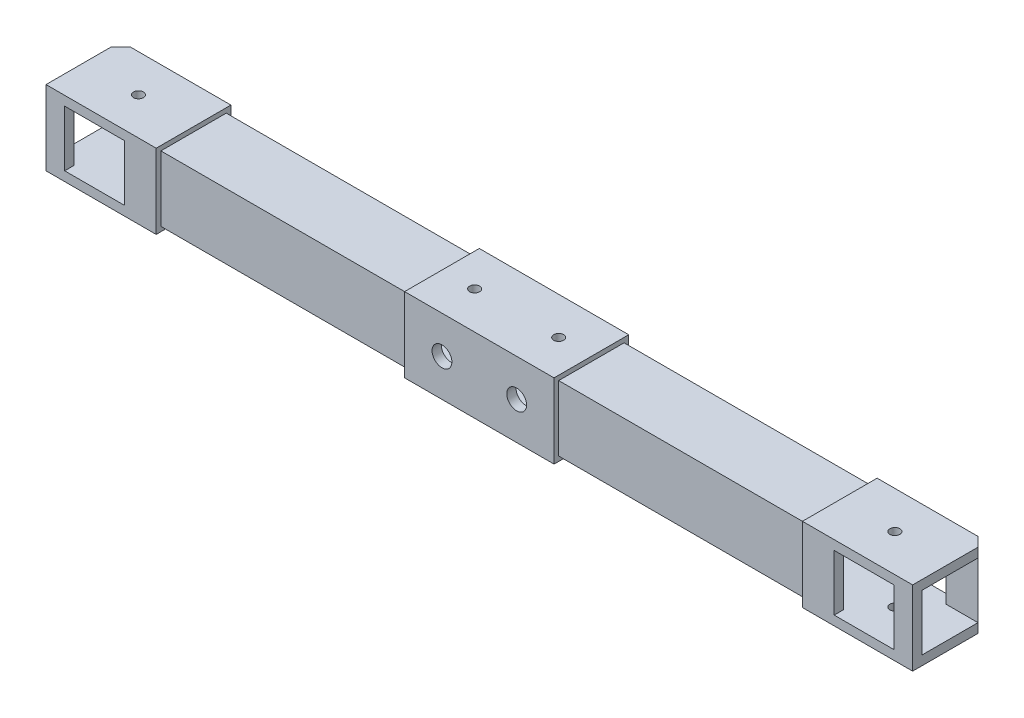
from build123d import *

# Parameters (mm, degrees)
SKETCH1_W               = 50.8
SKETCH1_H               = 50.8
SKETCH1_W_2             = 38.1
SKETCH1_H_2             = 38.1
EXTRUDE1_DEPTH          = 355.6
F_1_2_CLEARANCE_HOLE1_D = 13.49248
EXTRUDE3_REACH          = 362.107
SKETCH6_W               = 40.64
SKETCH6_H               = 38.1
EXTRUDE4_REACH          = 362.107
SKETCH7_W               = 40.64
SKETCH7_H               = 38.1
SKETCH8_W               = 48.26
SKETCH8_H               = 50.8
EXTRUDE5_DEPTH          = 361.10715072
F_1_4_CLEARANCE_HOLE1_D = 6.7564
F_1_4_CLEARANCE_HOLE2_D = 6.7564
EXTRUDE6_DEPTH          = 361.10715072
EXTRUDE8_REACH          = 314.544
SKETCH17_R              = 9.525
SKETCH18_W              = 12.7
SKETCH18_H              = 50.8
EXTRUDE9_DEPTH          = 313.54387788
SKETCH19_W              = 168.91
SKETCH19_H              = 50.8
EXTRUDE10_DEPTH         = 3.175
SKETCH20_W              = 168.91
SKETCH20_H              = 44.45
EXTRUDE11_DEPTH         = 3.175
MIRROR5_COPY_1_SKETCH_W = 168.91
MIRROR5_COPY_1_SKETCH_H = 50.8
MIRROR5_COPY_1_DEPTH    = 3.175
MIRROR5_COPY_2_SKETCH_W = 168.91
MIRROR5_COPY_2_SKETCH_H = 44.45
MIRROR5_COPY_2_DEPTH    = 3.175


with BuildPart() as part:
    # Sketch1 → Extrude1 (new, symmetric)
    with BuildSketch(Plane(origin=(0, 0, 0), x_dir=(0, 0, -1), z_dir=(1, 0, 0))):
        Rectangle(SKETCH1_W, SKETCH1_H)
        Rectangle(SKETCH1_W_2, SKETCH1_H_2, mode=Mode.SUBTRACT)
    extrude(amount=EXTRUDE1_DEPTH, both=True)

    # 1/2 Clearance Hole1 (through all)
    with Locations(Plane.XY.offset(25.4)):
        with Locations((25.4, 0), (-25.4, 0)):
            Hole(F_1_2_CLEARANCE_HOLE1_D / 2)

    # Sketch6 → Extrude3 (cut, up to next)
    with BuildSketch(Plane.XY.offset(25.4), mode=Mode.PRIVATE) as extrude3_sk1:
        with Locations((-261.62, 0)):
            Rectangle(SKETCH6_W, SKETCH6_H)
    extrude3_tool1 = extrude(extrude3_sk1.sketch, amount=-EXTRUDE3_REACH, mode=Mode.PRIVATE) & part.part
    extrude3 = extrude3_tool1.solids().sort_by_distance((-261.62, 0, 25.4))[0]
    add(extrude3, mode=Mode.SUBTRACT)

    # Sketch7 → Extrude4 (cut, up to next)
    with BuildSketch(Plane(origin=(0, 0, -25.4), x_dir=(-1, 0, 0), z_dir=(0, 0, -1)), mode=Mode.PRIVATE) as extrude4_sk1:
        with Locations((252.73, 0)):
            Rectangle(SKETCH7_W, SKETCH7_H)
    extrude4_tool1 = extrude(extrude4_sk1.sketch, amount=-EXTRUDE4_REACH, mode=Mode.PRIVATE) & part.part
    extrude4 = extrude4_tool1.solids().sort_by_distance((-252.73, 0, -25.4))[0]
    add(extrude4, mode=Mode.SUBTRACT)

    # Sketch8 → Extrude5 (cut, through all)
    with BuildSketch(Plane.XY.offset(25.4)):
        with Locations((-331.47, 0)):
            Rectangle(SKETCH8_W, SKETCH8_H)
    extrude5 = extrude(amount=-EXTRUDE5_DEPTH, mode=Mode.SUBTRACT)

    # 1/4 Clearance Hole1 (through all)
    with Locations(Plane(origin=(0, 25.4, 0), x_dir=(-1, 0, 0), z_dir=(0, 1, 0))):
        with Locations((257.175, 0)):
            f_1_4_clearance_hole1 = Hole(F_1_4_CLEARANCE_HOLE1_D / 2)

    # 1/4 Clearance Hole2 (through all)
    with Locations(Plane(origin=(0, 25.4, 0), x_dir=(-1, 0, 0), z_dir=(0, 1, 0))):
        with Locations((28.575, 0)):
            f_1_4_clearance_hole2 = Hole(F_1_4_CLEARANCE_HOLE2_D / 2)

    # Sketch15 → Extrude6 (cut, through all)
    with BuildSketch(Plane(origin=(0, 25.4, 0), x_dir=(1, 0, 0), z_dir=(0, 1, 0))):
        Polygon((-307.34, 25.4), (-288.29, 25.4), (-307.34, 6.35), align=None)
    extrude6 = extrude(amount=-EXTRUDE6_DEPTH, mode=Mode.SUBTRACT)

    # Mirror1: Extrude3, Extrude4, Extrude5, 1/4 Clearance Hole1, 1/4 Clearance Hole2, Extrude6 across plane
    add(extrude3.mirror(Plane(origin=(0, 0, 0), x_dir=(0, 0, 1), z_dir=(1, 0, 0))), mode=Mode.SUBTRACT)
    add(extrude4.mirror(Plane(origin=(0, 0, 0), x_dir=(0, 0, 1), z_dir=(1, 0, 0))), mode=Mode.SUBTRACT)
    add(extrude5.mirror(Plane(origin=(0, 0, 0), x_dir=(0, 0, 1), z_dir=(1, 0, 0))), mode=Mode.SUBTRACT)
    add(f_1_4_clearance_hole1.mirror(Plane(origin=(0, 0, 0), x_dir=(0, 0, 1), z_dir=(1, 0, 0))), mode=Mode.SUBTRACT)
    add(f_1_4_clearance_hole2.mirror(Plane(origin=(0, 0, 0), x_dir=(0, 0, 1), z_dir=(1, 0, 0))), mode=Mode.SUBTRACT)
    add(extrude6.mirror(Plane(origin=(0, 0, 0), x_dir=(0, 0, 1), z_dir=(1, 0, 0))), mode=Mode.SUBTRACT)

    # Sketch17 → Extrude8 (cut, up to next)
    with BuildSketch(Plane.XZ.offset(25.4), mode=Mode.PRIVATE) as extrude8_sk1:
        with Locations(Location((-28.575, 0, 0), (0, 0, 270))):
            Circle(SKETCH17_R)
    extrude8_tool1 = extrude(extrude8_sk1.sketch, amount=-EXTRUDE8_REACH, mode=Mode.PRIVATE) & part.part
    # Sketch17 → Extrude8 (cut, up to next)
    with BuildSketch(Plane.XZ.offset(25.4), mode=Mode.PRIVATE) as extrude8_sk2:
        with Locations(Location((28.575, 0, 0), (0, 0, 270))):
            Circle(SKETCH17_R)
    extrude8_tool2 = extrude(extrude8_sk2.sketch, amount=-EXTRUDE8_REACH, mode=Mode.PRIVATE) & part.part
    add(extrude8_tool1.solids().sort_by_distance((-28.575, -25.4, 0))[0], mode=Mode.SUBTRACT)
    add(extrude8_tool2.solids().sort_by_distance((28.575, -25.4, 0))[0], mode=Mode.SUBTRACT)

    # Sketch18 → Extrude9 (cut, through all)
    with BuildSketch(Plane(origin=(0, 25.4, 0), x_dir=(1, 0, 0), z_dir=(0, 1, 0))):
        with Locations((-300.99, 0)):
            Rectangle(SKETCH18_W, SKETCH18_H)
    extrude9 = extrude(amount=-EXTRUDE9_DEPTH, mode=Mode.SUBTRACT)

    # Mirror2: Extrude9 across plane
    add(extrude9.mirror(Plane(origin=(0, 0, 0), x_dir=(0, 0, 1), z_dir=(1, 0, 0))), mode=Mode.SUBTRACT)

    # Sketch19 → Extrude10 (cut)
    with BuildSketch(Plane(origin=(0, 0, -25.4), x_dir=(-1, 0, 0), z_dir=(0, 0, -1))):
        with Locations((-135.255, 0)):
            Rectangle(SKETCH19_W, SKETCH19_H)
    extrude10 = extrude(amount=-EXTRUDE10_DEPTH, mode=Mode.SUBTRACT)

    # Mirror3: Extrude10 across plane
    add(extrude10.mirror(Plane.XY), mode=Mode.SUBTRACT)

    # Sketch20 → Extrude11 (cut)
    with BuildSketch(Plane.XZ.offset(25.4)):
        with Locations((135.255, 0)):
            Rectangle(SKETCH20_W, SKETCH20_H)
    extrude11 = extrude(amount=-EXTRUDE11_DEPTH, mode=Mode.SUBTRACT)

    # Mirror4: Extrude11 across plane
    add(extrude11.mirror(Plane.ZX), mode=Mode.SUBTRACT)

    # Mirror5: Extrude10, Extrude11 across plane
    add(extrude10.mirror(Plane(origin=(0, 0, 0), x_dir=(0, 0, 1), z_dir=(1, 0, 0))), mode=Mode.SUBTRACT)
    add(extrude11.mirror(Plane(origin=(0, 0, 0), x_dir=(0, 0, 1), z_dir=(1, 0, 0))), mode=Mode.SUBTRACT)

    # Mirror5 copy 1 sketch → Mirror5 copy 1 (cut)
    with BuildSketch(Plane.XY.offset(25.4)):
        with Locations((-135.255, 0)):
            Rectangle(MIRROR5_COPY_1_SKETCH_W, MIRROR5_COPY_1_SKETCH_H)
    extrude(amount=-MIRROR5_COPY_1_DEPTH, mode=Mode.SUBTRACT)

    # Mirror5 copy 2 sketch → Mirror5 copy 2 (cut)
    with BuildSketch(Plane(origin=(0, 25.4, 0), x_dir=(-1, 0, 0), z_dir=(0, 1, 0))):
        with Locations((135.255, 0)):
            Rectangle(MIRROR5_COPY_2_SKETCH_W, MIRROR5_COPY_2_SKETCH_H)
    extrude(amount=-MIRROR5_COPY_2_DEPTH, mode=Mode.SUBTRACT)


solid = part.part
